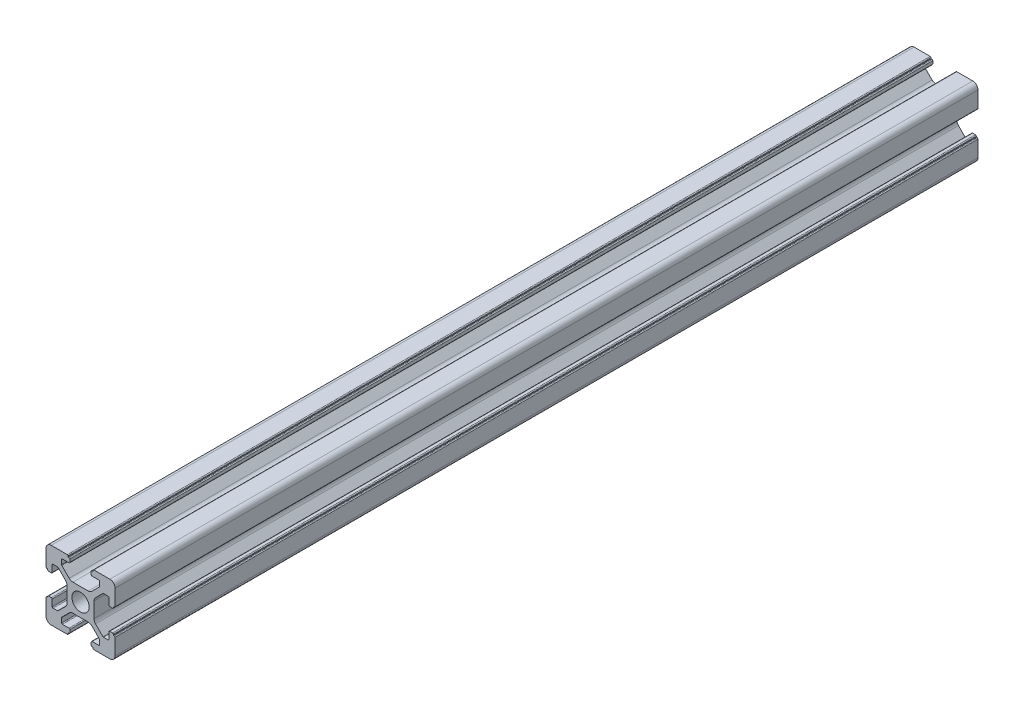
from build123d import *

# Parameters (mm, degrees)
SKETCH_1_R      = 2.5
EXTRUDE_1_DEPTH = 125


with BuildPart() as part:
    # 草图1 → 凸台-拉伸1 (new, symmetric)
    with BuildSketch(Plane.XY):
        with BuildLine():
            Line((-8.502261885, -10.002261885), (-3.85, -10.002261885))
            ThreePointArc((-3.85, -10.002261885), (-3.673223305, -9.929038581), (-3.6, -9.752261885))
            Line((-3.6, -9.752261885), (-3.6, -9.502261885))
            Line((-3.6, -9.502261885), (-3.35, -9.502261885))
            ThreePointArc((-3.35, -9.502261885), (-3.173223305, -9.429038581), (-3.1, -9.252261885))
            Line((-3.1, -9.252261885), (-3.1, -8.45))
            ThreePointArc((-3.1, -8.45), (-3.173223305, -8.273223305), (-3.35, -8.2))
            Line((-3.35, -8.2), (-5.25, -8.2))
            ThreePointArc((-5.25, -8.2), (-5.426776695, -8.126776695), (-5.5, -7.95))
            Line((-5.5, -7.95), (-5.5, -6.664213562))
            ThreePointArc((-5.5, -6.664213562), (-5.480969883, -6.568542704), (-5.426776695, -6.487436867))
            Line((-5.426776695, -6.487436867), (-3.278679656, -4.339339828))
            ThreePointArc((-3.278679656, -4.339339828), (-2.792044633, -4.014180701), (-2.218019485, -3.9))
            Line((-2.218019485, -3.9), (2.218019485, -3.9))
            ThreePointArc((2.218019485, -3.9), (2.792044633, -4.014180701), (3.278679656, -4.339339828))
            Line((3.278679656, -4.339339828), (5.426776695, -6.487436867))
            ThreePointArc((5.426776695, -6.487436867), (5.480969883, -6.568542704), (5.5, -6.664213562))
            Line((5.5, -6.664213562), (5.5, -7.95))
            ThreePointArc((5.5, -7.95), (5.426776695, -8.126776695), (5.25, -8.2))
            Line((5.25, -8.2), (3.35, -8.2))
            ThreePointArc((3.35, -8.2), (3.173223305, -8.273223305), (3.1, -8.45))
            Line((3.1, -8.45), (3.1, -9.252261885))
            ThreePointArc((3.1, -9.252261885), (3.173223305, -9.429038581), (3.35, -9.502261885))
            Line((3.35, -9.502261885), (3.6, -9.502261885))
            Line((3.6, -9.502261885), (3.6, -9.752261885))
            ThreePointArc((3.6, -9.752261885), (3.673223305, -9.929038581), (3.85, -10.002261885))
            Line((3.85, -10.002261885), (8.502261885, -10.002261885))
            ThreePointArc((8.502261885, -10.002261885), (9.562922057, -9.562922057), (10.002261885, -8.502261885))
            Line((10.002261885, -8.502261885), (10.002261885, -3.85))
            ThreePointArc((10.002261885, -3.85), (9.929038581, -3.673223305), (9.752261885, -3.6))
            Line((9.752261885, -3.6), (9.502261885, -3.6))
            Line((9.502261885, -3.6), (9.502261885, -3.35))
            ThreePointArc((9.502261885, -3.35), (9.429038581, -3.173223305), (9.252261885, -3.1))
            Line((9.252261885, -3.1), (8.45, -3.1))
            ThreePointArc((8.45, -3.1), (8.273223305, -3.173223305), (8.2, -3.35))
            Line((8.2, -3.35), (8.2, -5.25))
            ThreePointArc((8.2, -5.25), (8.126776695, -5.426776695), (7.95, -5.5))
            Line((7.95, -5.5), (6.664213562, -5.5))
            ThreePointArc((6.664213562, -5.5), (6.568542704, -5.480969883), (6.487436867, -5.426776695))
            Line((6.487436867, -5.426776695), (4.339339828, -3.278679656))
            ThreePointArc((4.339339828, -3.278679656), (4.014180701, -2.792044633), (3.9, -2.218019485))
            Line((3.9, -2.218019485), (3.9, 2.218019485))
            ThreePointArc((3.9, 2.218019485), (4.014180701, 2.792044633), (4.339339828, 3.278679656))
            Line((4.339339828, 3.278679656), (6.487436867, 5.426776695))
            ThreePointArc((6.487436867, 5.426776695), (6.568542704, 5.480969883), (6.664213562, 5.5))
            Line((6.664213562, 5.5), (7.95, 5.5))
            ThreePointArc((7.95, 5.5), (8.126776695, 5.426776695), (8.2, 5.25))
            Line((8.2, 5.25), (8.2, 3.35))
            ThreePointArc((8.2, 3.35), (8.273223305, 3.173223305), (8.45, 3.1))
            Line((8.45, 3.1), (9.252261885, 3.1))
            ThreePointArc((9.252261885, 3.1), (9.429038581, 3.173223305), (9.502261885, 3.35))
            Line((9.502261885, 3.35), (9.502261885, 3.6))
            Line((9.502261885, 3.6), (9.752261885, 3.6))
            ThreePointArc((9.752261885, 3.6), (9.929038581, 3.673223305), (10.002261885, 3.85))
            Line((10.002261885, 3.85), (10.002261885, 8.502261885))
            ThreePointArc((10.002261885, 8.502261885), (9.562922057, 9.562922057), (8.502261885, 10.002261885))
            Line((8.502261885, 10.002261885), (3.85, 10.002261885))
            ThreePointArc((3.85, 10.002261885), (3.673223305, 9.929038581), (3.6, 9.752261885))
            Line((3.6, 9.752261885), (3.6, 9.502261885))
            Line((3.6, 9.502261885), (3.35, 9.502261885))
            ThreePointArc((3.35, 9.502261885), (3.173223305, 9.429038581), (3.1, 9.252261885))
            Line((3.1, 9.252261885), (3.1, 8.45))
            ThreePointArc((3.1, 8.45), (3.173223305, 8.273223305), (3.35, 8.2))
            Line((3.35, 8.2), (5.25, 8.2))
            ThreePointArc((5.25, 8.2), (5.426776695, 8.126776695), (5.5, 7.95))
            Line((5.5, 7.95), (5.5, 6.664213562))
            ThreePointArc((5.5, 6.664213562), (5.480969883, 6.568542704), (5.426776695, 6.487436867))
            Line((5.426776695, 6.487436867), (3.278679656, 4.339339828))
            ThreePointArc((3.278679656, 4.339339828), (2.792044633, 4.014180701), (2.218019485, 3.9))
            Line((2.218019485, 3.9), (-2.218019485, 3.9))
            ThreePointArc((-2.218019485, 3.9), (-2.792044633, 4.014180701), (-3.278679656, 4.339339828))
            Line((-3.278679656, 4.339339828), (-5.426776695, 6.487436867))
            ThreePointArc((-5.426776695, 6.487436867), (-5.480969883, 6.568542704), (-5.5, 6.664213562))
            Line((-5.5, 6.664213562), (-5.5, 7.95))
            ThreePointArc((-5.5, 7.95), (-5.426776695, 8.126776695), (-5.25, 8.2))
            Line((-5.25, 8.2), (-3.35, 8.2))
            ThreePointArc((-3.35, 8.2), (-3.173223305, 8.273223305), (-3.1, 8.45))
            Line((-3.1, 8.45), (-3.1, 9.252261885))
            ThreePointArc((-3.1, 9.252261885), (-3.173223305, 9.429038581), (-3.35, 9.502261885))
            Line((-3.35, 9.502261885), (-3.6, 9.502261885))
            Line((-3.6, 9.502261885), (-3.6, 9.752261885))
            ThreePointArc((-3.6, 9.752261885), (-3.673223305, 9.929038581), (-3.85, 10.002261885))
            Line((-3.85, 10.002261885), (-8.502261885, 10.002261885))
            ThreePointArc((-8.502261885, 10.002261885), (-9.562922057, 9.562922057), (-10.002261885, 8.502261885))
            Line((-10.002261885, 8.502261885), (-10.002261885, 3.85))
            ThreePointArc((-10.002261885, 3.85), (-9.929038581, 3.673223305), (-9.752261885, 3.6))
            Line((-9.752261885, 3.6), (-9.502261885, 3.6))
            Line((-9.502261885, 3.6), (-9.502261885, 3.35))
            ThreePointArc((-9.502261885, 3.35), (-9.429038581, 3.173223305), (-9.252261885, 3.1))
            Line((-9.252261885, 3.1), (-8.45, 3.1))
            ThreePointArc((-8.45, 3.1), (-8.273223305, 3.173223305), (-8.2, 3.35))
            Line((-8.2, 3.35), (-8.2, 5.25))
            ThreePointArc((-8.2, 5.25), (-8.126776695, 5.426776695), (-7.95, 5.5))
            Line((-7.95, 5.5), (-6.664213562, 5.5))
            ThreePointArc((-6.664213562, 5.5), (-6.568542704, 5.480969883), (-6.487436867, 5.426776695))
            Line((-6.487436867, 5.426776695), (-4.339339828, 3.278679656))
            ThreePointArc((-4.339339828, 3.278679656), (-4.014180701, 2.792044633), (-3.9, 2.218019485))
            Line((-3.9, 2.218019485), (-3.9, -2.218019485))
            ThreePointArc((-3.9, -2.218019485), (-4.014180701, -2.792044633), (-4.339339828, -3.278679656))
            Line((-4.339339828, -3.278679656), (-6.487436867, -5.426776695))
            ThreePointArc((-6.487436867, -5.426776695), (-6.568542704, -5.480969883), (-6.664213562, -5.5))
            Line((-6.664213562, -5.5), (-7.95, -5.5))
            ThreePointArc((-7.95, -5.5), (-8.126776695, -5.426776695), (-8.2, -5.25))
            Line((-8.2, -5.25), (-8.2, -3.35))
            ThreePointArc((-8.2, -3.35), (-8.273223305, -3.173223305), (-8.45, -3.1))
            Line((-8.45, -3.1), (-9.252261885, -3.1))
            ThreePointArc((-9.252261885, -3.1), (-9.429038581, -3.173223305), (-9.502261885, -3.35))
            Line((-9.502261885, -3.35), (-9.502261885, -3.6))
            Line((-9.502261885, -3.6), (-9.752261885, -3.6))
            ThreePointArc((-9.752261885, -3.6), (-9.929038581, -3.673223305), (-10.002261885, -3.85))
            Line((-10.002261885, -3.85), (-10.002261885, -8.502261885))
            ThreePointArc((-10.002261885, -8.502261885), (-9.562922057, -9.562922057), (-8.502261885, -10.002261885))
        make_face()
        Circle(SKETCH_1_R, mode=Mode.SUBTRACT)
    extrude(amount=EXTRUDE_1_DEPTH, both=True)


solid = part.part
